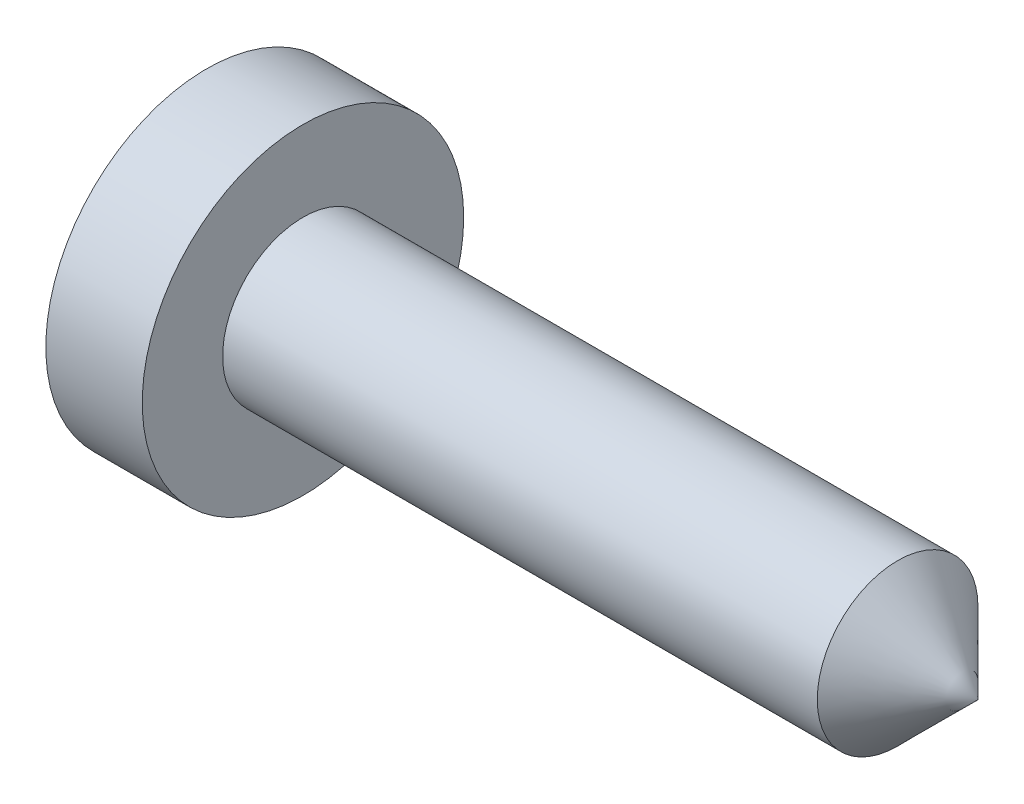
from build123d import *

# Parameters (mm, degrees)
SKETCH1_R           = 5
BOSS_EXTRUDE1_DEPTH = 3
SKETCH3_R           = 2.5
BOSS_EXTRUDE2_DEPTH = 18.5


with BuildPart() as part:
    # Sketch1 → Boss-Extrude1 (new body)
    with BuildSketch(Plane(origin=(0, 0, 0), x_dir=(0, 0, -1), z_dir=(1, 0, 0))):
        Circle(SKETCH1_R)
    extrude(amount=BOSS_EXTRUDE1_DEPTH)

    # Sketch3 → Boss-Extrude2 (add)
    with BuildSketch(Plane(origin=(3, 0, 0), x_dir=(0, 0, -1), z_dir=(1, 0, 0))):
        Circle(SKETCH3_R)
    extrude(amount=BOSS_EXTRUDE2_DEPTH)

    # Sketch4 → Revolve1 (revolve)
    with BuildSketch(Plane.XY, mode=Mode.PRIVATE) as revolve1_sk:
        Polygon((21.5, 0), (24, 0), (21.5, 2.5), align=None)
    revolve(revolve1_sk.sketch.rotate(Axis((21.5, 0, 0), (1, 0, 0)), 90), axis=Axis((21.5, 0, 0), (1, 0, 0)))


solid = part.part
